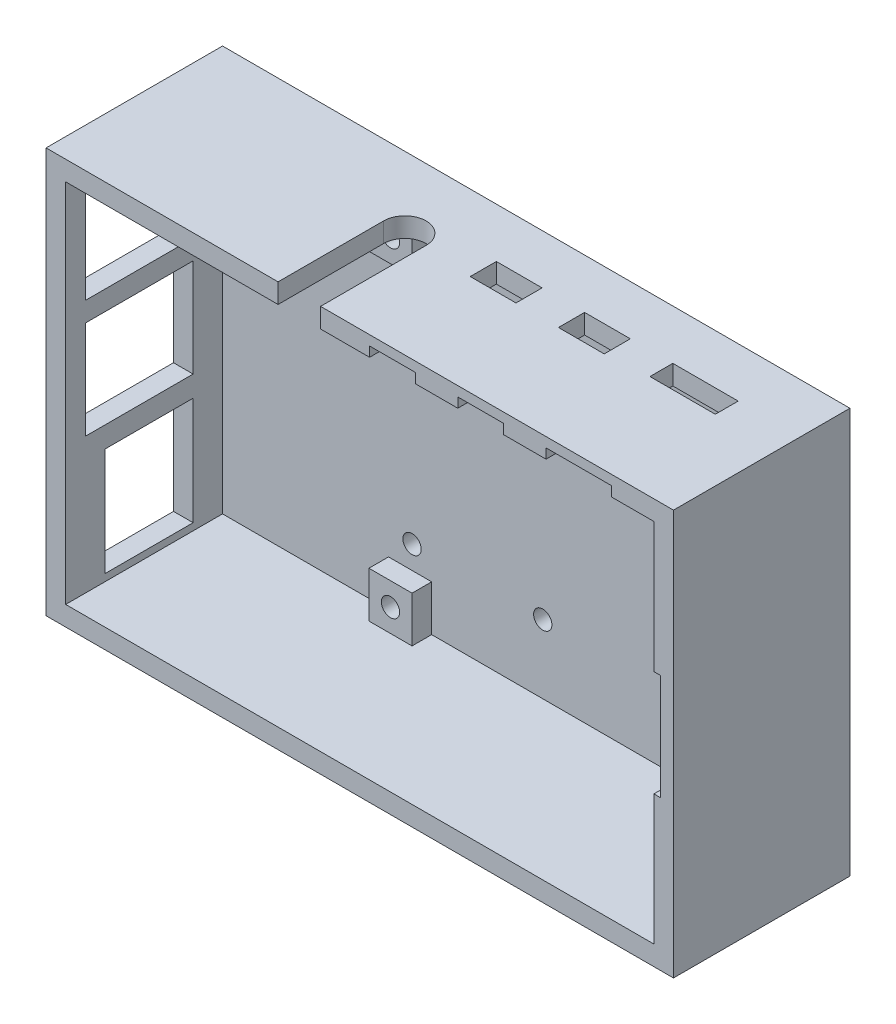
from build123d import *

# Parameters (mm, degrees)
SKETCH_1_W               = 90
SKETCH_1_H               = 56
SKETCH_1_R               = 1.4
EXTRUDE_1_DEPTH          = 3
SKETCH_2_W               = 6.6
SKETCH_2_H               = 7
SKETCH_2_R               = 1.4
EXTRUDE_2_DEPTH          = 3
SKETCH_3_W               = 96
SKETCH_3_H               = 62
SKETCH_3_W_2             = 90
SKETCH_3_H_2             = 56
EXTRUDE_3_DEPTH          = 27
SKETCH_4_W               = 16.5
SKETCH_4_H               = 15
SKETCH_4_W_2             = 13.5
SKETCH_4_H_2             = 16.5
CUT_EXTRUDE_1_DEPTH      = 3
CUT_EXTRUDE_2_REACH      = 84.928
SKETCH_5_W               = 10
SKETCH_5_H               = 3.5
SKETCH_5_W_2             = 7
SKETCH_5_H_2             = 4
CUT_EXTRUDE_3_REACH      = 65.198
SKETCH_6_W               = 7
SKETCH_6_H               = 1.5
SKETCH_6_W_2             = 10
CUT_EXTRUDE_6_DEPTH      = 64.198101237
CUT_EXTRUDE_6_DEPTH_BACK = 5
SKETCH_7_W               = 2
SKETCH_7_H               = 16.2
SKETCH_8_R               = 1.4
CUT_EXTRUDE_7_DEPTH      = 5


with BuildPart() as part:
    # 스케치1 → 보스-돌출1 (new body)
    with BuildSketch(Plane.XY):
        Rectangle(SKETCH_1_W, SKETCH_1_H)
        with Locations((-16.3, 24.5)):
            Circle(SKETCH_1_R, mode=Mode.SUBTRACT)
        with Locations((41.7, 24.5)):
            Circle(SKETCH_1_R, mode=Mode.SUBTRACT)
        with Locations(Location((41.7, -24.5, 0), (0, 0, 180))):
            Circle(SKETCH_1_R, mode=Mode.SUBTRACT)
        with Locations(Location((-16.3, -24.5, 0), (0, 0, 180))):
            Circle(SKETCH_1_R, mode=Mode.SUBTRACT)
    extrude(amount=EXTRUDE_1_DEPTH)

    # 스케치2 → 보스-돌출2 (add)
    # profile 1 of 4: a face of its own
    with BuildSketch(Plane.XY.offset(3)):
        with Locations((-16.3, 24.5)):
            Rectangle(SKETCH_2_W, SKETCH_2_H)
        with Locations((-16.3, 24.5)):
            Circle(SKETCH_2_R, mode=Mode.SUBTRACT)
    # profile 2 of 4: a face of its own
    with BuildSketch(Plane.XY.offset(3)):
        with Locations((41.7, 24.5)):
            Rectangle(SKETCH_2_W, SKETCH_2_H)
        with Locations((41.7, 24.5)):
            Circle(SKETCH_2_R, mode=Mode.SUBTRACT)
    # profile 3 of 4: a face of its own
    with BuildSketch(Plane.XY.offset(3)):
        with Locations((41.7, -24.5)):
            Rectangle(SKETCH_2_W, SKETCH_2_H)
        with Locations(Location((41.7, -24.5, 0), (0, 0, 180))):
            Circle(SKETCH_2_R, mode=Mode.SUBTRACT)
    # profile 4 of 4: a face of its own
    with BuildSketch(Plane.XY.offset(3)):
        with Locations((-16.3, -24.5)):
            Rectangle(SKETCH_2_W, SKETCH_2_H)
        with Locations(Location((-16.3, -24.5, 0), (0, 0, 180))):
            Circle(SKETCH_2_R, mode=Mode.SUBTRACT)
    extrude(amount=EXTRUDE_2_DEPTH)

    # 스케치3 → 보스-돌출3 (add)
    with BuildSketch(Plane.XY):
        Rectangle(SKETCH_3_W, SKETCH_3_H)
        Rectangle(SKETCH_3_W_2, SKETCH_3_H_2, mode=Mode.SUBTRACT)
    extrude(amount=EXTRUDE_3_DEPTH)

    # 스케치4 → 컷-돌출1 (cut)
    with BuildSketch(Plane.ZY.offset(48)):
        with Locations((15.75, 18.280682484)):
            Rectangle(SKETCH_4_W, SKETCH_4_H)
        with Locations((15.75, 0.280682484)):
            Rectangle(SKETCH_4_W, SKETCH_4_H)
        with Locations((14.25, -18.669317516)):
            Rectangle(SKETCH_4_W_2, SKETCH_4_H_2)
    extrude(amount=-CUT_EXTRUDE_1_DEPTH, mode=Mode.SUBTRACT)

    # 스케치5 → 컷-돌출2 (cut, up to next)
    with BuildSketch(Plane(origin=(0, 31, 0), x_dir=(1, 0, 0), z_dir=(0, 1, 0)), mode=Mode.PRIVATE) as cut_extrude_2_sk1:
        with Locations((33.5, -9.35)):
            Rectangle(SKETCH_5_W, SKETCH_5_H)
    cut_extrude_2_tool1 = extrude(cut_extrude_2_sk1.sketch, amount=-CUT_EXTRUDE_2_REACH, mode=Mode.PRIVATE) & part.part
    # 스케치5 → 컷-돌출2 (cut, up to next)
    with BuildSketch(Plane(origin=(0, 31, 0), x_dir=(1, 0, 0), z_dir=(0, 1, 0)), mode=Mode.PRIVATE) as cut_extrude_2_sk2:
        with Locations((18.5, -9.6)):
            Rectangle(SKETCH_5_W_2, SKETCH_5_H_2)
    cut_extrude_2_tool2 = extrude(cut_extrude_2_sk2.sketch, amount=-CUT_EXTRUDE_2_REACH, mode=Mode.PRIVATE) & part.part
    # 스케치5 → 컷-돌출2 (cut, up to next)
    with BuildSketch(Plane(origin=(0, 31, 0), x_dir=(1, 0, 0), z_dir=(0, 1, 0)), mode=Mode.PRIVATE) as cut_extrude_2_sk3:
        with Locations((5, -9.6)):
            Rectangle(SKETCH_5_W_2, SKETCH_5_H_2)
    cut_extrude_2_tool3 = extrude(cut_extrude_2_sk3.sketch, amount=-CUT_EXTRUDE_2_REACH, mode=Mode.PRIVATE) & part.part
    # 스케치5 → 컷-돌출2 (cut, up to next)
    with BuildSketch(Plane(origin=(0, 31, 0), x_dir=(1, 0, 0), z_dir=(0, 1, 0)), mode=Mode.PRIVATE) as cut_extrude_2_sk4:
        with BuildLine():
            Line((-12.5, -10.85), (-12.5, -27))
            Line((-12.5, -27), (-6, -27))
            Line((-6, -27), (-6, -10.85))
            ThreePointArc((-6, -10.85), (-9.25, -7.6), (-12.5, -10.85))
        make_face()
    cut_extrude_2_tool4 = extrude(cut_extrude_2_sk4.sketch, amount=-CUT_EXTRUDE_2_REACH, mode=Mode.PRIVATE) & part.part
    add(cut_extrude_2_tool1.solids().sort_by_distance((33.5, 31, 9.35))[0], mode=Mode.SUBTRACT)
    add(cut_extrude_2_tool2.solids().sort_by_distance((18.5, 31, 9.6))[0], mode=Mode.SUBTRACT)
    add(cut_extrude_2_tool3.solids().sort_by_distance((5, 31, 9.6))[0], mode=Mode.SUBTRACT)
    add(cut_extrude_2_tool4.solids().sort_by_distance((-9.25, 31, 17.634661))[0], mode=Mode.SUBTRACT)

    # 스케치6 → 컷-돌출3 (cut, up to next)
    with BuildSketch(Plane.XY.offset(27), mode=Mode.PRIVATE) as cut_extrude_3_sk1:
        with Locations((5, 28.75)):
            Rectangle(SKETCH_6_W, SKETCH_6_H)
    cut_extrude_3_tool1 = extrude(cut_extrude_3_sk1.sketch, amount=-CUT_EXTRUDE_3_REACH, mode=Mode.PRIVATE) & part.part
    # 스케치6 → 컷-돌출3 (cut, up to next)
    with BuildSketch(Plane.XY.offset(27), mode=Mode.PRIVATE) as cut_extrude_3_sk2:
        with Locations((18.5, 28.75)):
            Rectangle(SKETCH_6_W, SKETCH_6_H)
    cut_extrude_3_tool2 = extrude(cut_extrude_3_sk2.sketch, amount=-CUT_EXTRUDE_3_REACH, mode=Mode.PRIVATE) & part.part
    # 스케치6 → 컷-돌출3 (cut, up to next)
    with BuildSketch(Plane.XY.offset(27), mode=Mode.PRIVATE) as cut_extrude_3_sk3:
        with Locations((33.5, 28.75)):
            Rectangle(SKETCH_6_W_2, SKETCH_6_H)
    cut_extrude_3_tool3 = extrude(cut_extrude_3_sk3.sketch, amount=-CUT_EXTRUDE_3_REACH, mode=Mode.PRIVATE) & part.part
    add(cut_extrude_3_tool1.solids().sort_by_distance((5, 28.75, 27))[0], mode=Mode.SUBTRACT)
    add(cut_extrude_3_tool2.solids().sort_by_distance((18.5, 28.75, 27))[0], mode=Mode.SUBTRACT)
    add(cut_extrude_3_tool3.solids().sort_by_distance((33.5, 28.75, 27))[0], mode=Mode.SUBTRACT)

    # 스케치7 → 컷-돌출6 (cut, two sides: drawn at the far end of the back side and taken through both)
    with BuildSketch(Plane.XY.offset(-CUT_EXTRUDE_6_DEPTH_BACK)):
        with Locations((45, 0)):
            Rectangle(SKETCH_7_W, SKETCH_7_H)
    extrude(amount=CUT_EXTRUDE_6_DEPTH + CUT_EXTRUDE_6_DEPTH_BACK, mode=Mode.SUBTRACT)

    # 스케치8 → 컷-돌출7 (cut)
    with BuildSketch(Plane(origin=(0, 0, 0), x_dir=(-1, 0, 0), z_dir=(0, 0, -1))):
        with Locations((-4, 17.5)):
            Circle(SKETCH_8_R)
        with Locations((16, 17.5)):
            Circle(SKETCH_8_R)
        with Locations(Location((-4, -17.5, 0), (0, 0, 180))):
            Circle(SKETCH_8_R)
        with Locations(Location((16, -17.5, 0), (0, 0, 180))):
            Circle(SKETCH_8_R)
    extrude(amount=-CUT_EXTRUDE_7_DEPTH, mode=Mode.SUBTRACT)


solid = part.part
